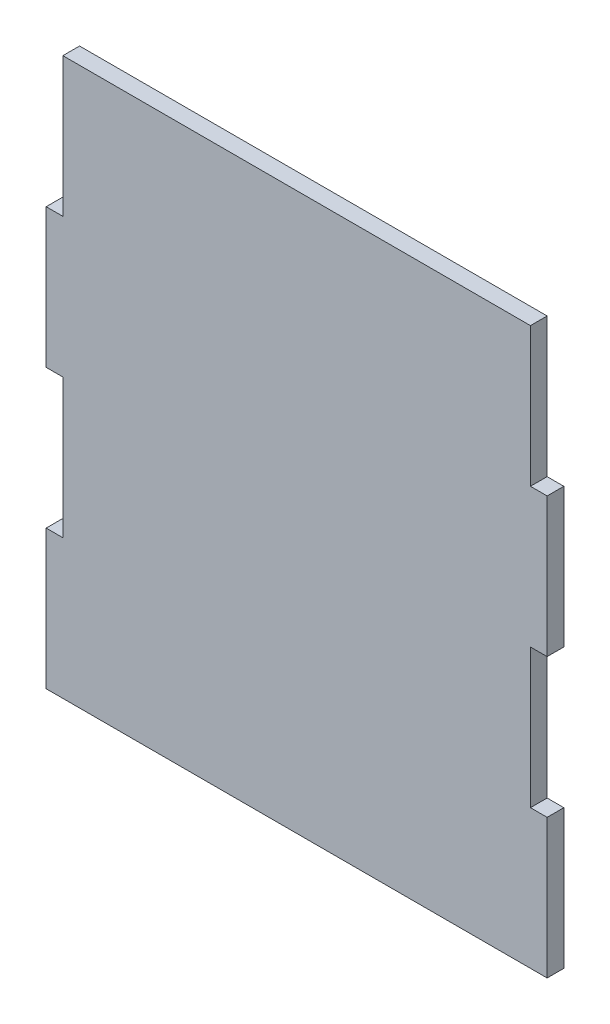
from build123d import *

# Parameters (mm, degrees)
ESQUISSE1_W             = 90
ESQUISSE1_H             = 100
BOSS_EXTRU_1_DEPTH      = 3
ESQUISSE2_W             = 3
ESQUISSE2_H             = 25
ENL_V_MAT_EXTRU_1_DEPTH = 3


with BuildPart() as part:
    # Esquisse1 → Boss.-Extru.1 (new body)
    with BuildSketch(Plane.XY):
        with Locations((45, 50)):
            Rectangle(ESQUISSE1_W, ESQUISSE1_H)
    extrude(amount=BOSS_EXTRU_1_DEPTH)

    # Esquisse2 → Enlèv. mat.-Extru.1 (cut)
    with BuildSketch(Plane.XY.offset(3)):
        with Locations((1.5, 87.5)):
            Rectangle(ESQUISSE2_W, ESQUISSE2_H)
        with Locations((1.5, 37.5)):
            Rectangle(ESQUISSE2_W, ESQUISSE2_H)
        with Locations((88.5, 87.5)):
            Rectangle(ESQUISSE2_W, ESQUISSE2_H)
        with Locations((88.5, 37.5)):
            Rectangle(ESQUISSE2_W, ESQUISSE2_H)
    extrude(amount=-ENL_V_MAT_EXTRU_1_DEPTH, mode=Mode.SUBTRACT)


solid = part.part
